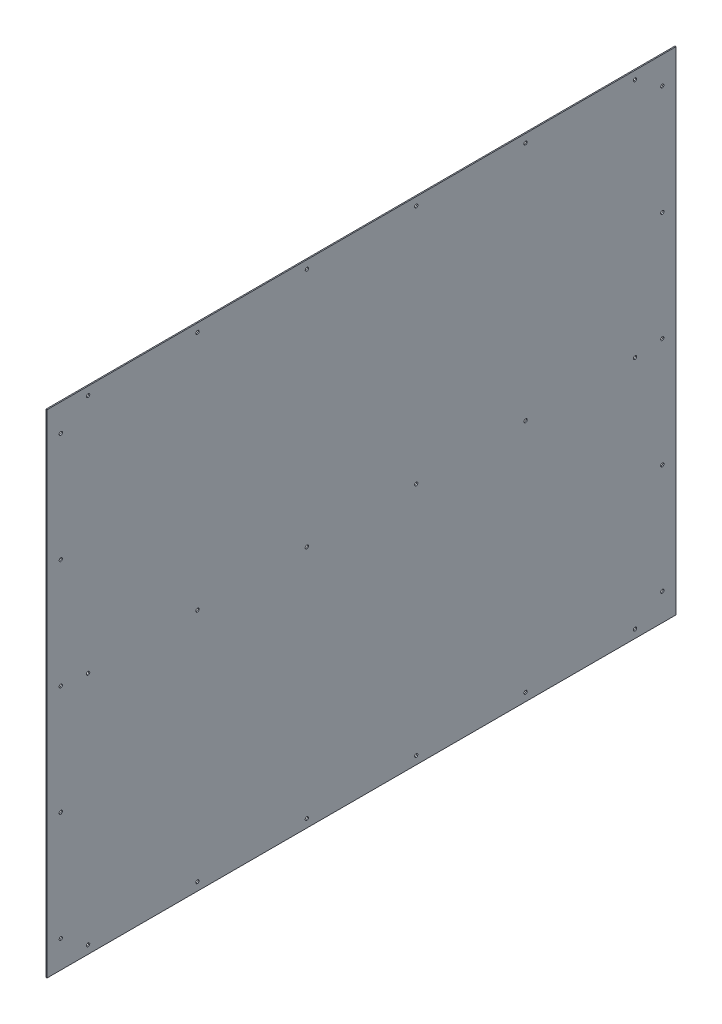
from build123d import *

# Parameters (mm, degrees)
SKETCH1_W           = 1150
SKETCH1_H           = 900
BOSS_EXTRUDE1_DEPTH = 2
SKETCH2_R           = 3
CUT_EXTRUDE1_DEPTH  = 2
SKETCH3_R           = 3
CUT_EXTRUDE2_DEPTH  = 10


with BuildPart() as part:
    # Sketch1 → Boss-Extrude1 (new body)
    with BuildSketch(Plane(origin=(0, 0, 0), x_dir=(0, 0, -1), z_dir=(1, 0, 0))):
        Rectangle(SKETCH1_W, SKETCH1_H)
    extrude(amount=BOSS_EXTRUDE1_DEPTH)

    # Sketch2 → Cut-Extrude1 (cut)
    with BuildSketch(Plane(origin=(2, 0, 0), x_dir=(0, 0, -1), z_dir=(1, 0, 0))):
        with Locations((-500, 435)):
            Circle(SKETCH2_R)
        with Locations((-300, 435)):
            Circle(SKETCH2_R)
        with Locations((-100, 435)):
            Circle(SKETCH2_R)
        with Locations((100, 435)):
            Circle(SKETCH2_R)
        with Locations((300, 435)):
            Circle(SKETCH2_R)
        with Locations((500, 435)):
            Circle(SKETCH2_R)
        with Locations(Location((500, -435, 0), (0, 0, 180))):
            Circle(SKETCH2_R)
        with Locations(Location((300, -435, 0), (0, 0, 180))):
            Circle(SKETCH2_R)
        with Locations(Location((100, -435, 0), (0, 0, 180))):
            Circle(SKETCH2_R)
        with Locations(Location((-100, -435, 0), (0, 0, 180))):
            Circle(SKETCH2_R)
        with Locations(Location((-300, -435, 0), (0, 0, 180))):
            Circle(SKETCH2_R)
        with Locations(Location((-500, -435, 0), (0, 0, 180))):
            Circle(SKETCH2_R)
        with Locations((500, -5)):
            Circle(SKETCH2_R)
        with Locations((100, -5)):
            Circle(SKETCH2_R)
        with Locations((300, -5)):
            Circle(SKETCH2_R)
        with Locations((-100, -5)):
            Circle(SKETCH2_R)
        with Locations((-300, -5)):
            Circle(SKETCH2_R)
        with Locations((-500, -5)):
            Circle(SKETCH2_R)
    extrude(amount=-CUT_EXTRUDE1_DEPTH, mode=Mode.SUBTRACT)

    # Sketch3 → Cut-Extrude2 (cut)
    with BuildSketch(Plane(origin=(2, 0, 0), x_dir=(0, 0, -1), z_dir=(1, 0, 0))):
        with Locations((-550, 400)):
            Circle(SKETCH3_R)
        with Locations((-550, 200)):
            Circle(SKETCH3_R)
        with Locations((-550, 0)):
            Circle(SKETCH3_R)
        with Locations((-550, -200)):
            Circle(SKETCH3_R)
        with Locations((-550, -400)):
            Circle(SKETCH3_R)
        with Locations(Location((550, -400, 0), (0, 0, 180))):
            Circle(SKETCH3_R)
        with Locations(Location((550, -200, 0), (0, 0, 180))):
            Circle(SKETCH3_R)
        with Locations(Location((550, 0, 0), (0, 0, 180))):
            Circle(SKETCH3_R)
        with Locations(Location((550, 200, 0), (0, 0, 180))):
            Circle(SKETCH3_R)
        with Locations(Location((550, 400, 0), (0, 0, 180))):
            Circle(SKETCH3_R)
    extrude(amount=-CUT_EXTRUDE2_DEPTH, mode=Mode.SUBTRACT)


solid = part.part
